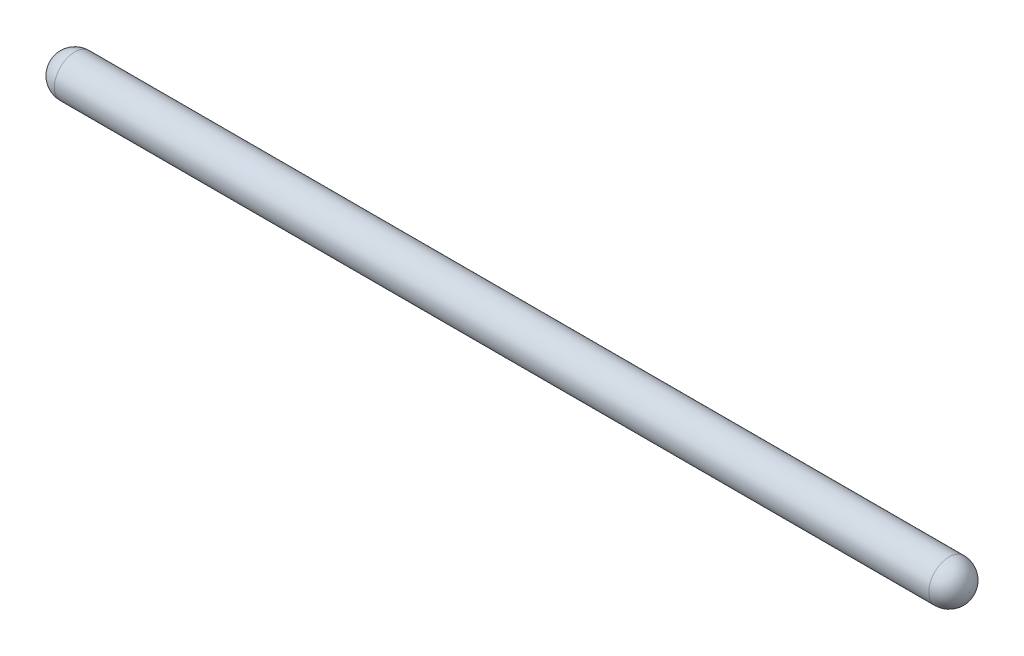
from build123d import *

# Parameters (mm, degrees)
SKETCH1_R           = 15.222228559
BOSS_EXTRUDE1_DEPTH = 680
FILLET1_R           = 15


with BuildPart() as part:
    # Sketch1 → Boss-Extrude1 (new body)
    with BuildSketch(Plane(origin=(1051.94567778, 0, 0), x_dir=(0, 0, -1), z_dir=(1, 0, 0))):
        with Locations((-1240.681396917, 1075.980159729)):
            Circle(SKETCH1_R)
    extrude(amount=-BOSS_EXTRUDE1_DEPTH)

    # Fillet1
    fillet1_edges = [part.edges().sort_by_distance(p)[0] for p in [
        (1051.94567778, 1075.980159729, 1255.903625475),
        (371.94567778, 1075.980159729, 1255.903625475),
    ]]
    fillet(fillet1_edges, radius=FILLET1_R)


solid = part.part
